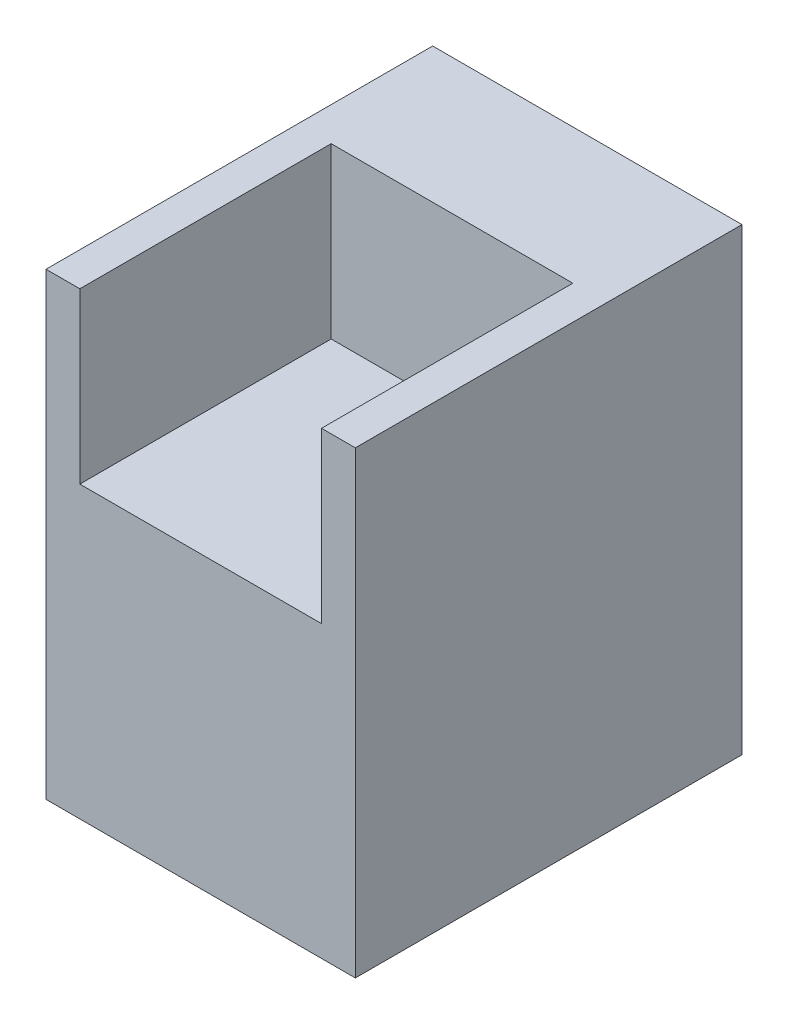
from build123d import *

# Parameters (mm, degrees)
SKETCH1_W                               = 640
SKETCH1_H                               = 950
PRESS_PZP400_GOVDE_SATIN_ALINAN_1_DEPTH = 800
PRESS_PZP400_GOVDE_SATIN_ALINAN_2_START = 1
SKETCH2_W                               = 500
SKETCH2_H                               = 360
PRESS_PZP400_GOVDE_SATIN_ALINAN_2_DEPTH = 521


with BuildPart() as part:
    # Sketch1 → PRESS_PZP400_govde_SATIN_ALINAN_1 (new body)
    with BuildSketch(Plane.XY):
        with Locations((350, 595)):
            Rectangle(SKETCH1_W, SKETCH1_H)
    extrude(amount=-PRESS_PZP400_GOVDE_SATIN_ALINAN_1_DEPTH)

    # Sketch2 → PRESS_PZP400_govde_SATIN_ALINAN_2 (cut)
    with BuildSketch(Plane.XY.offset(PRESS_PZP400_GOVDE_SATIN_ALINAN_2_START)):
        with Locations((350, 900)):
            Rectangle(SKETCH2_W, SKETCH2_H)
    extrude(amount=-PRESS_PZP400_GOVDE_SATIN_ALINAN_2_DEPTH, mode=Mode.SUBTRACT)


solid = part.part
